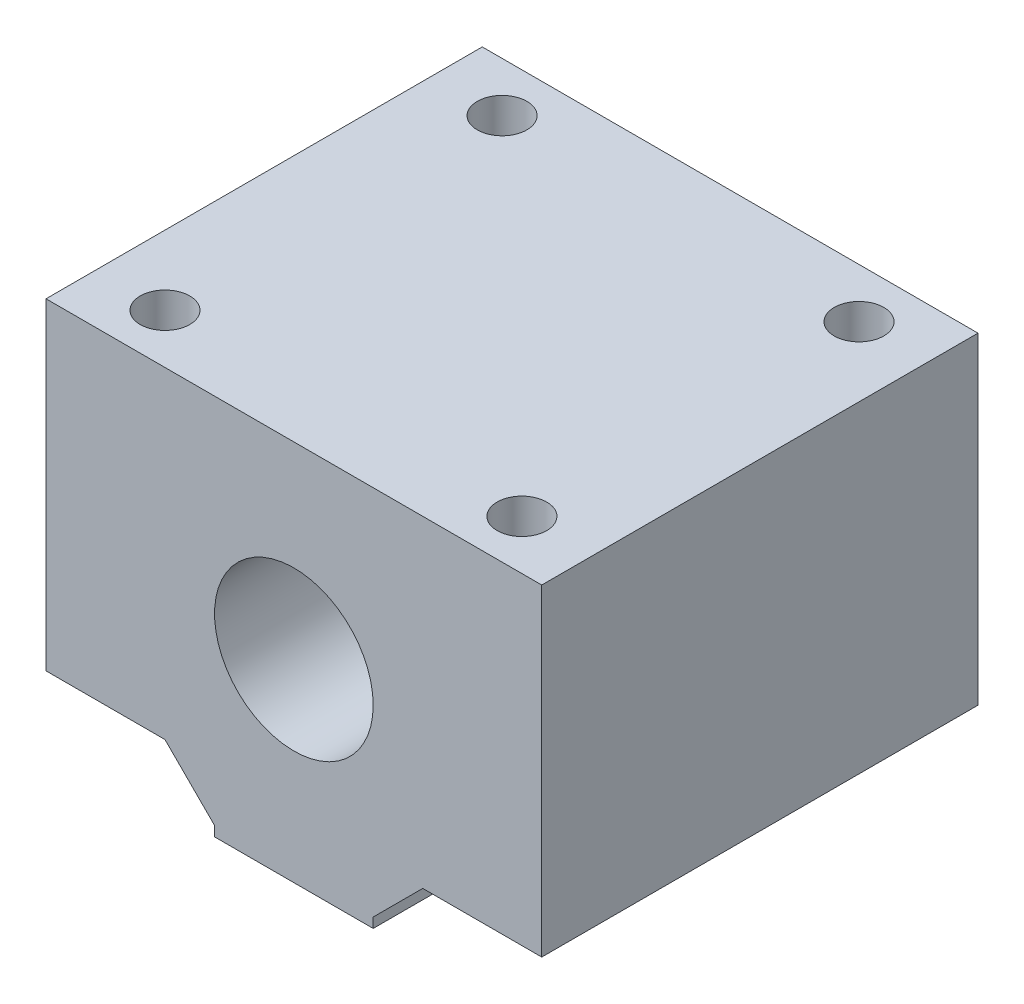
from build123d import *

# Parameters (mm, degrees)
SKETCH_1_R          = 8
EXTRUDE_1_DEPTH     = 44
SKETCH_2_R          = 2.5
CUT_EXTRUDE_1_DEPTH = 64.586555183


with BuildPart() as part:
    # 草图1 → 凸台-拉伸1 (new body)
    with BuildSketch(Plane.XY):
        Polygon((8, 0), (-8, 0), (-8, 1), (-13, 6), (-25, 6), (-25, 38.5), (25, 38.5), (25, 6), (13, 6), (8, 1), align=None)
        with Locations((0, 19.5)):
            Circle(SKETCH_1_R, mode=Mode.SUBTRACT)
    extrude(amount=EXTRUDE_1_DEPTH)

    # 草图2 → 切除-拉伸1 (cut, through all)
    with BuildSketch(Plane(origin=(0, 38.5, 0), x_dir=(1, 0, 0), z_dir=(0, 1, 0))):
        with Locations(Location((-18, -5, 0), (0, 0, 270))):
            Circle(SKETCH_2_R)
        with Locations(Location((18, -5, 0), (0, 0, 270))):
            Circle(SKETCH_2_R)
        with Locations(Location((18, -39, 0), (0, 0, 270))):
            Circle(SKETCH_2_R)
        with Locations(Location((-18, -39, 0), (0, 0, 270))):
            Circle(SKETCH_2_R)
    extrude(amount=-CUT_EXTRUDE_1_DEPTH, mode=Mode.SUBTRACT)


solid = part.part
